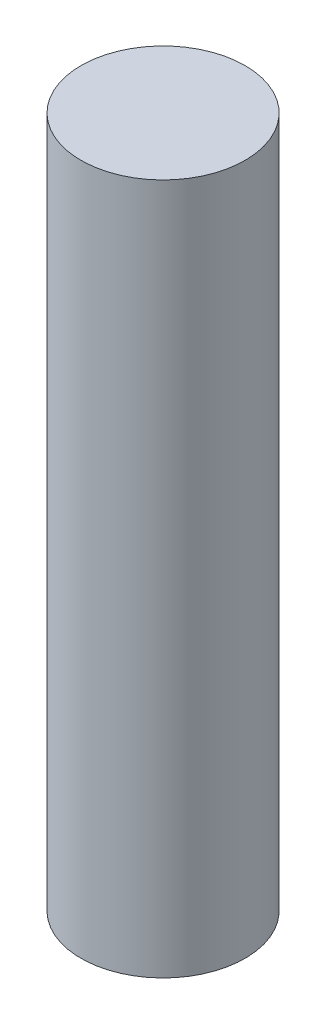
from build123d import *

# Parameters (mm, degrees)
SKETCH1_R           = 47.508864924
BOSS_EXTRUDE1_DEPTH = 400


with BuildPart() as part:
    # Sketch1 → Boss-Extrude1 (new body)
    with BuildSketch(Plane(origin=(0, 0, 0), x_dir=(1, 0, 0), z_dir=(0, 1, 0))):
        with Locations(Location((0, 0, 0), (0, 0, 90))):
            Circle(SKETCH1_R)
    extrude(amount=BOSS_EXTRUDE1_DEPTH)


solid = part.part
